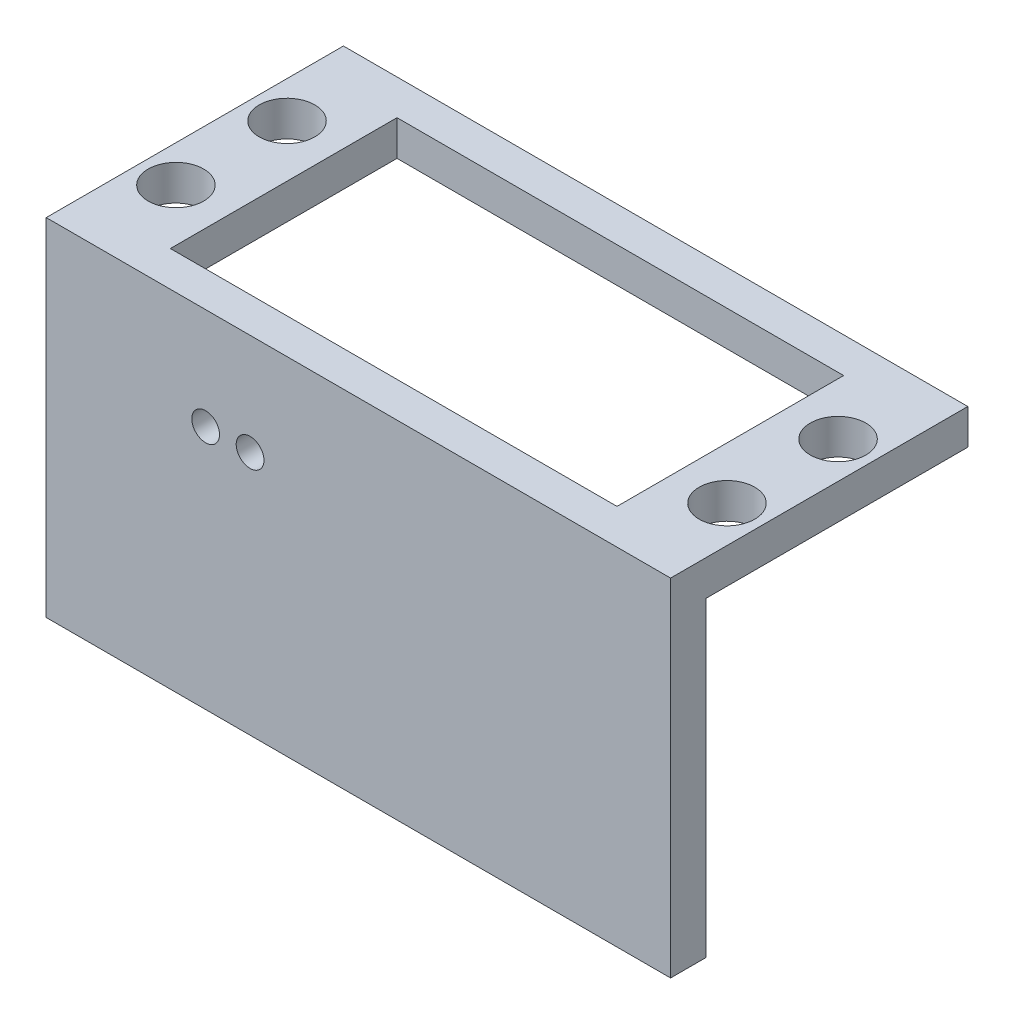
from build123d import *

# Parameters (mm, degrees)
SKETCH1_W           = 56.2
SKETCH1_H           = 26.75
SKETCH1_R           = 2.5
SKETCH1_W_2         = 40.2
SKETCH1_H_2         = 20.4
BOSS_EXTRUDE1_DEPTH = 3.175
SKETCH2_W           = 56.2
SKETCH2_H           = 3.175
BOSS_EXTRUDE2_DEPTH = 28
SKETCH3_R           = 1.25
CUT_EXTRUDE1_DEPTH  = 3.175


with BuildPart() as part:
    # Sketch1 → Boss-Extrude1 (new body)
    with BuildSketch(Plane(origin=(0, 0, 0), x_dir=(1, 0, 0), z_dir=(0, 1, 0))):
        Rectangle(SKETCH1_W, SKETCH1_H)
        with Locations(Location((24.8, 5, 0), (0, 0, 270))):
            Circle(SKETCH1_R, mode=Mode.SUBTRACT)
        with Locations(Location((24.8, -5, 0), (0, 0, 270))):
            Circle(SKETCH1_R, mode=Mode.SUBTRACT)
        with Locations(Location((-24.8, -5, 0), (0, 0, 90))):
            Circle(SKETCH1_R, mode=Mode.SUBTRACT)
        with Locations(Location((-24.8, 5, 0), (0, 0, 90))):
            Circle(SKETCH1_R, mode=Mode.SUBTRACT)
        Rectangle(SKETCH1_W_2, SKETCH1_H_2, mode=Mode.SUBTRACT)
    extrude(amount=BOSS_EXTRUDE1_DEPTH)

    # Sketch2 → Boss-Extrude2 (add)
    with BuildSketch(Plane(origin=(0, 0, 0), x_dir=(-1, 0, 0), z_dir=(0, -1, 0))):
        with Locations((0, -11.7875)):
            Rectangle(SKETCH2_W, SKETCH2_H)
    extrude(amount=BOSS_EXTRUDE2_DEPTH)

    # Sketch3 → Cut-Extrude1 (cut)
    with BuildSketch(Plane.XY.offset(13.375)):
        with Locations((-9.75, -5.953329294)):
            Circle(SKETCH3_R)
        with Locations((-13.75, -5.953329294)):
            Circle(SKETCH3_R)
    extrude(amount=-CUT_EXTRUDE1_DEPTH, mode=Mode.SUBTRACT)


solid = part.part
